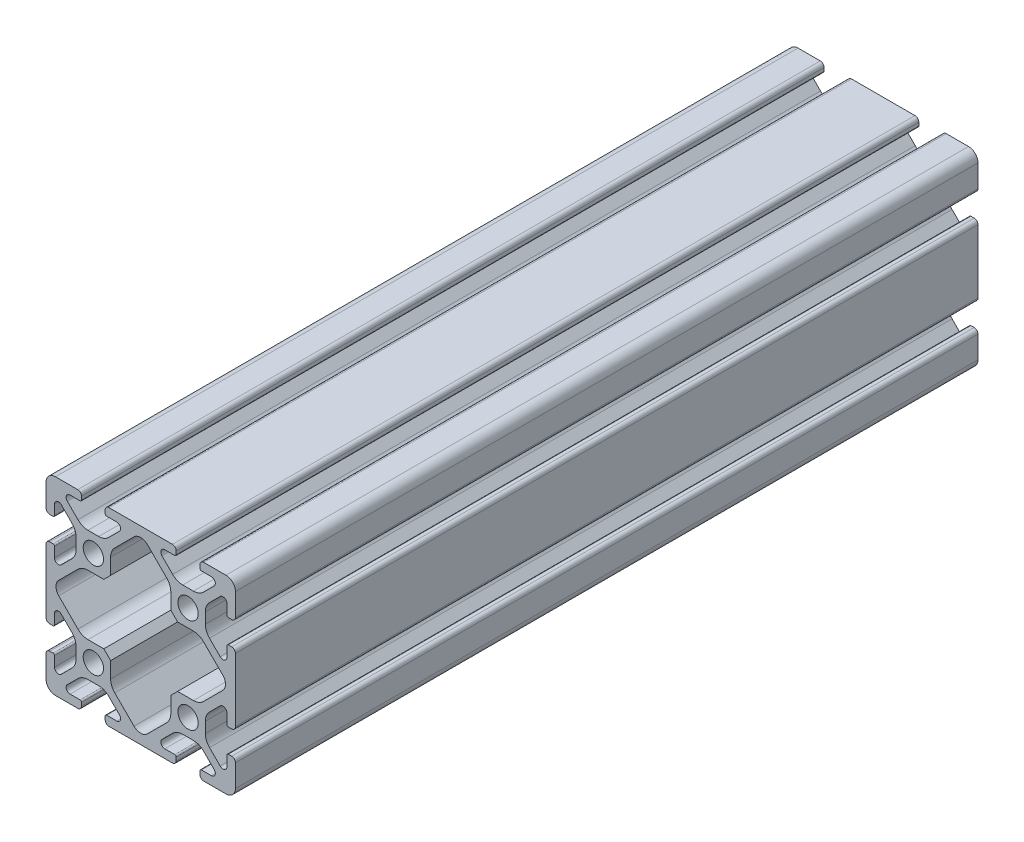
from build123d import *

# Parameters (mm, degrees)
ESQUISSE1_R      = 2.15
EXTRUSION1_DEPTH = 156.8


with BuildPart() as part:
    # Esquisse1 → Extrusion1 (new body)
    with BuildSketch(Plane(origin=(0, 0, 0), x_dir=(-1, 0, 0), z_dir=(0, 0, -1))):
        with BuildLine():
            Line((0, 13.3), (0, 26.7))
            ThreePointArc((0, 26.7), (-0.234314575, 27.265685425), (-0.8, 27.5))
            Line((-0.8, 27.5), (-1.5, 27.5))
            ThreePointArc((-1.5, 27.5), (-1.712132034, 27.412132034), (-1.8, 27.2))
            Line((-1.8, 27.2), (-1.8, 25.081575939))
            ThreePointArc((-1.8, 25.081575939), (-2.313345604, 24.313299949), (-3.219588924, 24.493562953))
            Line((-3.219588924, 24.493562953), (-5.471320344, 26.745294373))
            ThreePointArc((-5.471320344, 26.745294373), (-6.121638598, 27.718564419), (-6.35, 28.866614716))
            Line((-6.35, 28.866614716), (-6.35, 31.133385284))
            ThreePointArc((-6.35, 31.133385284), (-6.121638598, 32.281435581), (-5.471320344, 33.254705627))
            Line((-5.471320344, 33.254705627), (-3.219588924, 35.506437047))
            ThreePointArc((-3.219588924, 35.506437047), (-2.313345604, 35.686700051), (-1.8, 34.918424061))
            Line((-1.8, 34.918424061), (-1.8, 32.8))
            ThreePointArc((-1.8, 32.8), (-1.712132034, 32.587867966), (-1.5, 32.5))
            Line((-1.5, 32.5), (-0.8, 32.5))
            ThreePointArc((-0.8, 32.5), (-0.234314575, 32.734314575), (0, 33.3))
            Line((0, 33.3), (0, 38))
            ThreePointArc((0, 38), (-0.585786438, 39.414213562), (-2, 40))
            Line((-2, 40), (-6.7, 40))
            ThreePointArc((-6.7, 40), (-7.265685425, 39.765685425), (-7.5, 39.2))
            Line((-7.5, 39.2), (-7.5, 38.5))
            ThreePointArc((-7.5, 38.5), (-7.412132034, 38.287867966), (-7.2, 38.2))
            Line((-7.2, 38.2), (-5.081575939, 38.2))
            ThreePointArc((-5.081575939, 38.2), (-4.313299949, 37.686654396), (-4.493562953, 36.780411076))
            Line((-4.493562953, 36.780411076), (-6.745294373, 34.528679656))
            ThreePointArc((-6.745294373, 34.528679656), (-7.718564419, 33.878361402), (-8.866614716, 33.65))
            Line((-8.866614716, 33.65), (-11.133385284, 33.65))
            ThreePointArc((-11.133385284, 33.65), (-12.281435581, 33.878361402), (-13.254705627, 34.528679656))
            Line((-13.254705627, 34.528679656), (-15.506437047, 36.780411076))
            ThreePointArc((-15.506437047, 36.780411076), (-15.686700051, 37.686654396), (-14.918424061, 38.2))
            Line((-14.918424061, 38.2), (-12.8, 38.2))
            ThreePointArc((-12.8, 38.2), (-12.587867966, 38.287867966), (-12.5, 38.5))
            Line((-12.5, 38.5), (-12.5, 39.2))
            ThreePointArc((-12.5, 39.2), (-12.734314575, 39.765685425), (-13.3, 40))
            Line((-13.3, 40), (-26.7, 40))
            ThreePointArc((-26.7, 40), (-27.265685425, 39.765685425), (-27.5, 39.2))
            Line((-27.5, 39.2), (-27.5, 38.5))
            ThreePointArc((-27.5, 38.5), (-27.412132034, 38.287867966), (-27.2, 38.2))
            Line((-27.2, 38.2), (-25.081575939, 38.2))
            ThreePointArc((-25.081575939, 38.2), (-24.313299949, 37.686654396), (-24.493562953, 36.780411076))
            Line((-24.493562953, 36.780411076), (-26.745294373, 34.528679656))
            ThreePointArc((-26.745294373, 34.528679656), (-27.718564419, 33.878361402), (-28.866614716, 33.65))
            Line((-28.866614716, 33.65), (-31.133385284, 33.65))
            ThreePointArc((-31.133385284, 33.65), (-32.281435581, 33.878361402), (-33.254705627, 34.528679656))
            Line((-33.254705627, 34.528679656), (-35.506437047, 36.780411076))
            ThreePointArc((-35.506437047, 36.780411076), (-35.686700051, 37.686654396), (-34.918424061, 38.2))
            Line((-34.918424061, 38.2), (-32.8, 38.2))
            ThreePointArc((-32.8, 38.2), (-32.587867966, 38.287867966), (-32.5, 38.5))
            Line((-32.5, 38.5), (-32.5, 39.2))
            ThreePointArc((-32.5, 39.2), (-32.734314575, 39.765685425), (-33.3, 40))
            Line((-33.3, 40), (-38, 40))
            ThreePointArc((-38, 40), (-39.414213562, 39.414213562), (-40, 38))
            Line((-40, 38), (-40, 33.3))
            ThreePointArc((-40, 33.3), (-39.765685425, 32.734314575), (-39.2, 32.5))
            Line((-39.2, 32.5), (-38.5, 32.5))
            ThreePointArc((-38.5, 32.5), (-38.287867966, 32.587867966), (-38.2, 32.8))
            Line((-38.2, 32.8), (-38.2, 34.918424061))
            ThreePointArc((-38.2, 34.918424061), (-37.686654396, 35.686700051), (-36.780411076, 35.506437047))
            Line((-36.780411076, 35.506437047), (-34.528679656, 33.254705627))
            ThreePointArc((-34.528679656, 33.254705627), (-33.878361402, 32.281435581), (-33.65, 31.133385284))
            Line((-33.65, 31.133385284), (-33.65, 28.866614716))
            ThreePointArc((-33.65, 28.866614716), (-33.878361402, 27.718564419), (-34.528679656, 26.745294373))
            Line((-34.528679656, 26.745294373), (-36.780411076, 24.493562953))
            ThreePointArc((-36.780411076, 24.493562953), (-37.686654396, 24.313299949), (-38.2, 25.081575939))
            Line((-38.2, 25.081575939), (-38.2, 27.2))
            ThreePointArc((-38.2, 27.2), (-38.287867966, 27.412132034), (-38.5, 27.5))
            Line((-38.5, 27.5), (-39.2, 27.5))
            ThreePointArc((-39.2, 27.5), (-39.765685425, 27.265685425), (-40, 26.7))
            Line((-40, 26.7), (-40, 13.3))
            ThreePointArc((-40, 13.3), (-39.765685425, 12.734314575), (-39.2, 12.5))
            Line((-39.2, 12.5), (-38.5, 12.5))
            ThreePointArc((-38.5, 12.5), (-38.287867966, 12.587867966), (-38.2, 12.8))
            Line((-38.2, 12.8), (-38.2, 14.918424061))
            ThreePointArc((-38.2, 14.918424061), (-37.686654396, 15.686700051), (-36.780411076, 15.506437047))
            Line((-36.780411076, 15.506437047), (-34.528679656, 13.254705627))
            ThreePointArc((-34.528679656, 13.254705627), (-33.878361402, 12.281435581), (-33.65, 11.133385284))
            Line((-33.65, 11.133385284), (-33.65, 8.866614716))
            ThreePointArc((-33.65, 8.866614716), (-33.878361402, 7.718564419), (-34.528679656, 6.745294373))
            Line((-34.528679656, 6.745294373), (-36.780411076, 4.493562953))
            ThreePointArc((-36.780411076, 4.493562953), (-37.686654396, 4.313299949), (-38.2, 5.081575939))
            Line((-38.2, 5.081575939), (-38.2, 7.2))
            ThreePointArc((-38.2, 7.2), (-38.287867966, 7.412132034), (-38.5, 7.5))
            Line((-38.5, 7.5), (-39.2, 7.5))
            ThreePointArc((-39.2, 7.5), (-39.765685425, 7.265685425), (-40, 6.7))
            Line((-40, 6.7), (-40, 2))
            ThreePointArc((-40, 2), (-39.414213562, 0.585786438), (-38, 0))
            Line((-38, 0), (-33.3, 0))
            ThreePointArc((-33.3, 0), (-32.734314575, 0.234314575), (-32.5, 0.8))
            Line((-32.5, 0.8), (-32.5, 1.5))
            ThreePointArc((-32.5, 1.5), (-32.587867966, 1.712132034), (-32.8, 1.8))
            Line((-32.8, 1.8), (-34.918424061, 1.8))
            ThreePointArc((-34.918424061, 1.8), (-35.686700051, 2.313345604), (-35.506437047, 3.219588924))
            Line((-35.506437047, 3.219588924), (-33.254705627, 5.471320344))
            ThreePointArc((-33.254705627, 5.471320344), (-32.281435581, 6.121638598), (-31.133385284, 6.35))
            Line((-31.133385284, 6.35), (-28.866614716, 6.35))
            ThreePointArc((-28.866614716, 6.35), (-27.718564419, 6.121638598), (-26.745294373, 5.471320344))
            Line((-26.745294373, 5.471320344), (-24.493562953, 3.219588924))
            ThreePointArc((-24.493562953, 3.219588924), (-24.313299949, 2.313345604), (-25.081575939, 1.8))
            Line((-25.081575939, 1.8), (-27.2, 1.8))
            ThreePointArc((-27.2, 1.8), (-27.412132034, 1.712132034), (-27.5, 1.5))
            Line((-27.5, 1.5), (-27.5, 0.8))
            ThreePointArc((-27.5, 0.8), (-27.265685425, 0.234314575), (-26.7, 0))
            Line((-26.7, 0), (-13.3, 0))
            ThreePointArc((-13.3, 0), (-12.734314575, 0.234314575), (-12.5, 0.8))
            Line((-12.5, 0.8), (-12.5, 1.5))
            ThreePointArc((-12.5, 1.5), (-12.587867966, 1.712132034), (-12.8, 1.8))
            Line((-12.8, 1.8), (-14.918424061, 1.8))
            ThreePointArc((-14.918424061, 1.8), (-15.686700051, 2.313345604), (-15.506437047, 3.219588924))
            Line((-15.506437047, 3.219588924), (-13.254705627, 5.471320344))
            ThreePointArc((-13.254705627, 5.471320344), (-12.281435581, 6.121638598), (-11.133385284, 6.35))
            Line((-11.133385284, 6.35), (-8.866614716, 6.35))
            ThreePointArc((-8.866614716, 6.35), (-7.718564419, 6.121638598), (-6.745294373, 5.471320344))
            Line((-6.745294373, 5.471320344), (-4.493562953, 3.219588924))
            ThreePointArc((-4.493562953, 3.219588924), (-4.313299949, 2.313345604), (-5.081575939, 1.8))
            Line((-5.081575939, 1.8), (-7.2, 1.8))
            ThreePointArc((-7.2, 1.8), (-7.412132034, 1.712132034), (-7.5, 1.5))
            Line((-7.5, 1.5), (-7.5, 0.8))
            ThreePointArc((-7.5, 0.8), (-7.265685425, 0.234314575), (-6.7, 0))
            Line((-6.7, 0), (-2, 0))
            ThreePointArc((-2, 0), (-0.585786438, 0.585786438), (0, 2))
            Line((0, 2), (0, 6.7))
            ThreePointArc((0, 6.7), (-0.234314575, 7.265685425), (-0.8, 7.5))
            Line((-0.8, 7.5), (-1.5, 7.5))
            ThreePointArc((-1.5, 7.5), (-1.712132034, 7.412132034), (-1.8, 7.2))
            Line((-1.8, 7.2), (-1.8, 5.081575939))
            ThreePointArc((-1.8, 5.081575939), (-2.313345604, 4.313299949), (-3.219588924, 4.493562953))
            Line((-3.219588924, 4.493562953), (-5.471320344, 6.745294373))
            ThreePointArc((-5.471320344, 6.745294373), (-6.121638598, 7.718564419), (-6.35, 8.866614716))
            Line((-6.35, 8.866614716), (-6.35, 11.133385284))
            ThreePointArc((-6.35, 11.133385284), (-6.121638598, 12.281435581), (-5.471320344, 13.254705627))
            Line((-5.471320344, 13.254705627), (-3.219588924, 15.506437047))
            ThreePointArc((-3.219588924, 15.506437047), (-2.313345604, 15.686700051), (-1.8, 14.918424061))
            Line((-1.8, 14.918424061), (-1.8, 12.8))
            ThreePointArc((-1.8, 12.8), (-1.712132034, 12.587867966), (-1.5, 12.5))
            Line((-1.5, 12.5), (-0.8, 12.5))
            ThreePointArc((-0.8, 12.5), (-0.234314575, 12.734314575), (0, 13.3))
        make_face()
        with Locations(Location((-10, 10, 0), (0, 0, 180))):
            Circle(ESQUISSE1_R, mode=Mode.SUBTRACT)
        with Locations(Location((-10, 30, 0), (0, 0, 180))):
            Circle(ESQUISSE1_R, mode=Mode.SUBTRACT)
        with Locations(Location((-30, 10, 0), (0, 0, 180))):
            Circle(ESQUISSE1_R, mode=Mode.SUBTRACT)
        with Locations(Location((-30, 30, 0), (0, 0, 180))):
            Circle(ESQUISSE1_R, mode=Mode.SUBTRACT)
        with BuildLine():
            Line((-12.207864344, 13.650000344), (-13.649999344, 12.207864344))
            Line((-13.649999344, 12.207864344), (-13.649999344, 8.865434344))
            ThreePointArc((-13.649999344, 8.865434344), (-13.878360746, 7.717384046), (-14.528679, 6.744114))
            Line((-14.528679, 6.744114), (-18.585787, 2.687006))
            ThreePointArc((-18.585787, 2.687006), (-20.000000562, 2.101219562), (-21.414214125, 2.687006))
            Line((-21.414214125, 2.687006), (-25.471320625, 6.7441125))
            ThreePointArc((-25.471320625, 6.7441125), (-26.121638879, 7.717382546), (-26.350000281, 8.865432844))
            Line((-26.350000281, 8.865432844), (-26.350000281, 12.207864844))
            Line((-26.350000281, 12.207864844), (-27.071068281, 12.928932844))
            Line((-27.071068281, 12.928932844), (-27.792135781, 13.650000344))
            Line((-27.792135781, 13.650000344), (-31.134567781, 13.650000344))
            ThreePointArc((-31.134567781, 13.650000344), (-32.282618078, 13.878361746), (-33.255888125, 14.52868))
            Line((-33.255888125, 14.52868), (-37.312995125, 18.585787))
            ThreePointArc((-37.312995125, 18.585787), (-37.898781562, 20.000000686), (-37.31299495, 21.414214299))
            Line((-37.31299495, 21.414214299), (-33.255887863, 25.471320386))
            ThreePointArc((-33.255887863, 25.471320386), (-32.282617907, 26.121638449), (-31.134567781, 26.349999781))
            Line((-31.134567781, 26.349999781), (-27.792134781, 26.349999781))
            Line((-27.792134781, 26.349999781), (-27.071067781, 27.071067781))
            Line((-27.071067781, 27.071067781), (-26.350000281, 27.792136281))
            Line((-26.350000281, 27.792136281), (-26.350000281, 31.134565362))
            ThreePointArc((-26.350000281, 31.134565362), (-26.121638808, 32.28261583), (-25.471320363, 33.255885967))
            Line((-25.471320363, 33.255885967), (-21.414212991, 37.31299234))
            ThreePointArc((-21.414212991, 37.31299234), (-19.999999603, 37.898778603), (-18.585786215, 37.31299234))
            Line((-18.585786215, 37.31299234), (-14.528679261, 33.255886386))
            ThreePointArc((-14.528679261, 33.255886386), (-13.878360817, 32.282616249), (-13.649999344, 31.134565781))
            Line((-13.649999344, 31.134565781), (-13.649999344, 27.792135781))
            Line((-13.649999344, 27.792135781), (-12.207863344, 26.349999781))
            Line((-12.207863344, 26.349999781), (-8.865431425, 26.349999781))
            ThreePointArc((-8.865431425, 26.349999781), (-7.717381299, 26.121638449), (-6.744111343, 25.471320386))
            Line((-6.744111343, 25.471320386), (-2.687005215, 21.414215258))
            ThreePointArc((-2.687005215, 21.414215258), (-2.101218603, 20.000001645), (-2.687005041, 18.585787959))
            Line((-2.687005041, 18.585787959), (-6.744113, 14.52868))
            ThreePointArc((-6.744113, 14.52868), (-7.717383046, 13.878361746), (-8.865433344, 13.650000344))
            Line((-8.865433344, 13.650000344), (-12.207864344, 13.650000344))
        make_face(mode=Mode.SUBTRACT)
    extrude(amount=-EXTRUSION1_DEPTH)


solid = part.part
